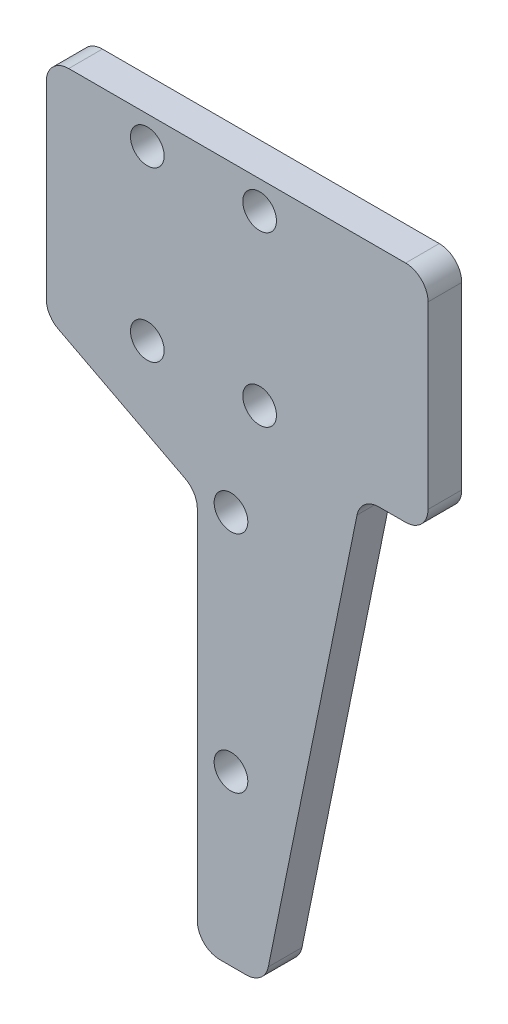
from build123d import *

# Parameters (mm, degrees)
SKETCH_1_R          = 1.5
EXTRUDE_1_DEPTH     = 3
SKETCH_4_R          = 1.5
CUT_EXTRUDE_1_DEPTH = 3
SKETCH_6_W          = 6
SKETCH_6_H          = 20
EXTRUDE_2_DEPTH     = 3
FILLET_1_R          = 2


with BuildPart() as part:
    # 草图1 → 凸台-拉伸1 (new body)
    with BuildSketch(Plane.XY):
        Polygon((-14, -10), (-0.55, -17), (-0.55, -52), (5.45, -52), (14, -10), (14, 10), (-14, 10), align=None)
        with Locations((5, 7.5)):
            Circle(SKETCH_1_R, mode=Mode.SUBTRACT)
        with Locations((5, -7.5)):
            Circle(SKETCH_1_R, mode=Mode.SUBTRACT)
        with Locations((-5, -7.5)):
            Circle(SKETCH_1_R, mode=Mode.SUBTRACT)
        with Locations((-5, 7.5)):
            Circle(SKETCH_1_R, mode=Mode.SUBTRACT)
    extrude(amount=EXTRUDE_1_DEPTH)

    # 草图4 → 切除-拉伸1 (cut)
    with BuildSketch(Plane.XY.offset(3)):
        with Locations((2.45, -37)):
            Circle(SKETCH_4_R)
        with Locations((2.45, -17)):
            Circle(SKETCH_4_R)
    extrude(amount=-CUT_EXTRUDE_1_DEPTH, mode=Mode.SUBTRACT)

    # 草图6 → 凸台-拉伸2 (add)
    with BuildSketch(Plane.XY.offset(3)):
        with Locations((17, 0)):
            Rectangle(SKETCH_6_W, SKETCH_6_H)
    extrude(amount=-EXTRUDE_2_DEPTH)

    # 圆角1
    fillet_1_edges = [part.edges().sort_by_distance(p)[0] for p in [
        (-0.55, -52, 1.5),
        (-0.55, -17, 1.5),
        (-14, -10, 1.5),
        (-14, 10, 1.5),
        (14, -10, 1.5),
        (5.45, -52, 1.5),
        (20, 10, 1.5),
        (20, -10, 1.5),
    ]]
    fillet(fillet_1_edges, radius=FILLET_1_R)


solid = part.part
